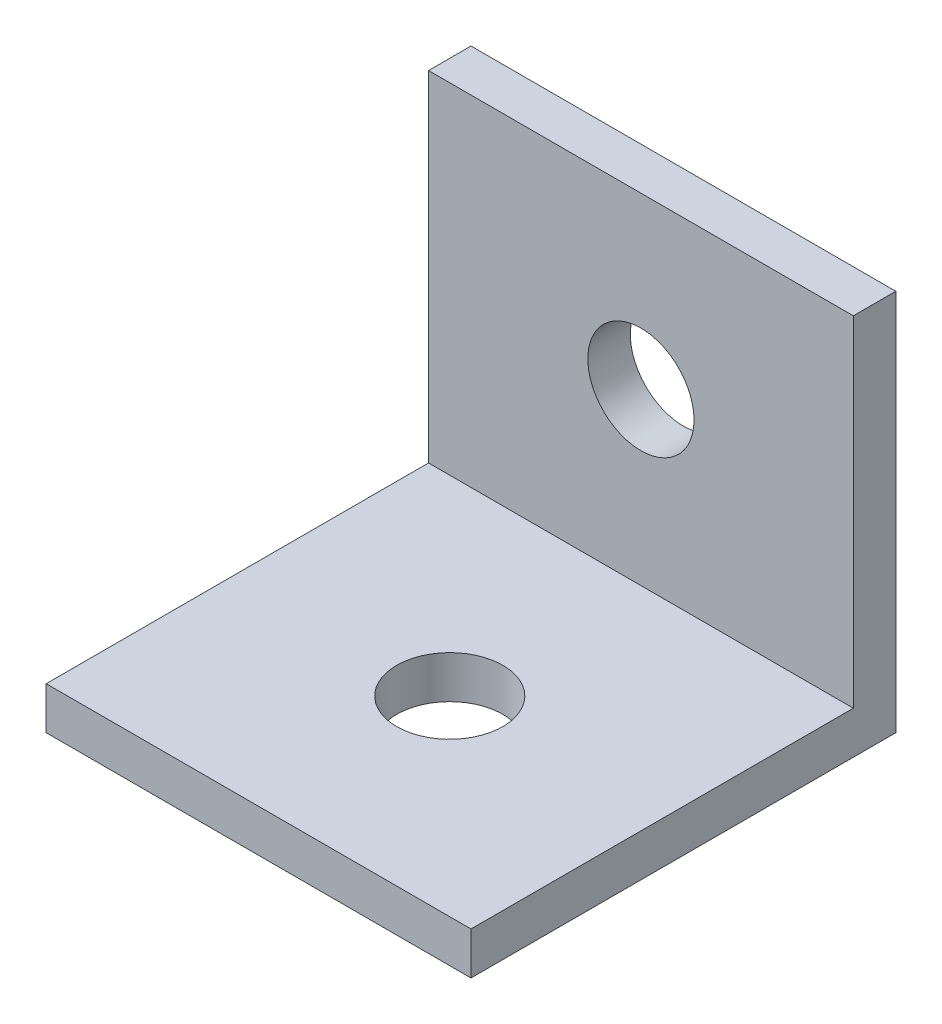
from build123d import *

# Parameters (mm, degrees)
SKETCH1_W           = 20
SKETCH1_H           = 20
BOSS_EXTRUDE1_DEPTH = 2
SKETCH2_W           = 20
SKETCH2_H           = 2
BOSS_EXTRUDE2_DEPTH = 16
SKETCH3_R           = 2.5
CUT_EXTRUDE1_DEPTH  = 22.354156504
SKETCH4_R           = 2.5
CUT_EXTRUDE2_DEPTH  = 28.349588662


with BuildPart() as part:
    # Sketch1 → Boss-Extrude1 (new body)
    with BuildSketch(Plane(origin=(0, 0, 0), x_dir=(1, 0, 0), z_dir=(0, 1, 0))):
        Rectangle(SKETCH1_W, SKETCH1_H)
    extrude(amount=BOSS_EXTRUDE1_DEPTH)

    # Sketch2 → Boss-Extrude2 (add)
    with BuildSketch(Plane(origin=(0, 2, 0), x_dir=(1, 0, 0), z_dir=(0, 1, 0))):
        with Locations((0, 9)):
            Rectangle(SKETCH2_W, SKETCH2_H)
    extrude(amount=BOSS_EXTRUDE2_DEPTH)

    # Sketch3 → Cut-Extrude1 (cut, through all)
    with BuildSketch(Plane(origin=(0, 2, 0), x_dir=(1, 0, 0), z_dir=(0, 1, 0))):
        with Locations(Location((0, -1, 0), (0, 0, 270))):
            Circle(SKETCH3_R)
    extrude(amount=-CUT_EXTRUDE1_DEPTH, mode=Mode.SUBTRACT)

    # Sketch4 → Cut-Extrude2 (cut, through all)
    with BuildSketch(Plane.XY.offset(-8)):
        with Locations((0, 10)):
            Circle(SKETCH4_R)
    extrude(amount=-CUT_EXTRUDE2_DEPTH, mode=Mode.SUBTRACT)


solid = part.part
